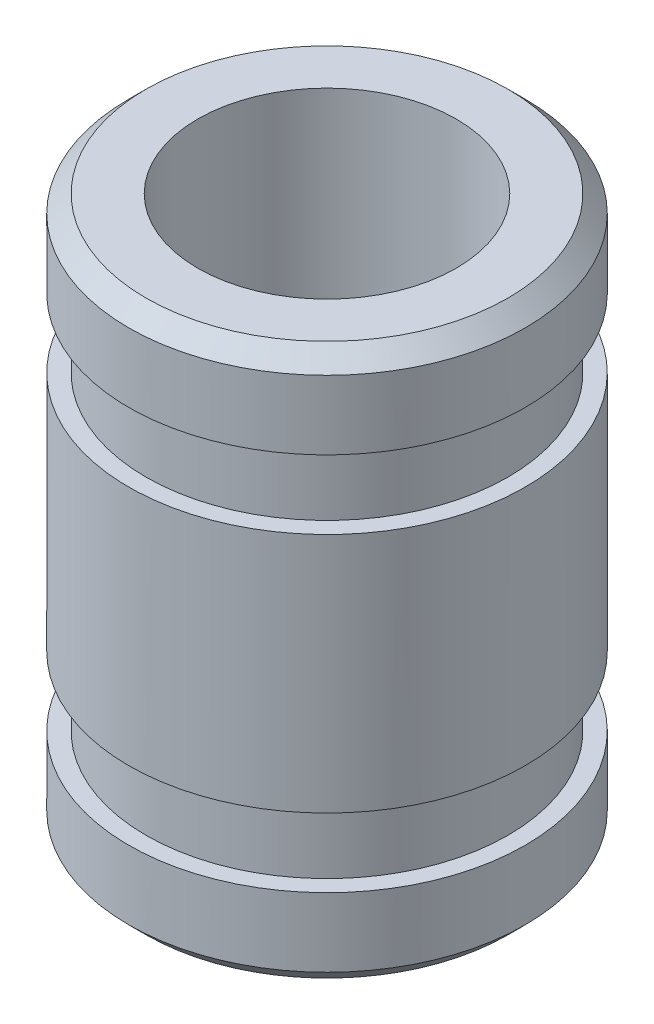
from build123d import *

# Parameters (mm, degrees)
SKETCH1_R           = 11.5
BOSS_EXTRUDE1_DEPTH = 32
SKETCH2_R           = 7.5
CUT_EXTRUDE1_DEPTH  = 32
SKETCH3_W           = 1
SKETCH3_H           = 4
SKETCH5_W           = 1
SKETCH5_H           = 4
CHAMFER2_SIZE       = 1


with BuildPart() as part:
    # Sketch1 → Boss-Extrude1 (new body)
    with BuildSketch(Plane(origin=(0, 0, 0), x_dir=(1, 0, 0), z_dir=(0, 1, 0))):
        with Locations(Location((0, 0, 0), (0, 0, 270))):
            Circle(SKETCH1_R)
    extrude(amount=BOSS_EXTRUDE1_DEPTH)

    # Sketch2 → Cut-Extrude1 (cut)
    with BuildSketch(Plane(origin=(0, 32, 0), x_dir=(1, 0, 0), z_dir=(0, 1, 0))):
        with Locations(Location((0, 0, 0), (0, 0, 270))):
            Circle(SKETCH2_R)
    extrude(amount=-CUT_EXTRUDE1_DEPTH, mode=Mode.SUBTRACT)

    # Cut-Sweep1: sweep along a path in Sketch4
    with BuildLine(Plane(origin=(0, 7, 0), x_dir=(-1, 0, 0), z_dir=(0, -1, 0))) as cut_sweep1_path:
        CenterArc((0, 0), 11, 0, 360)
    # Sketch3 → Cut-Sweep1 (sweep, cut)
    with BuildSketch(Plane.XY):
        with Locations((11, 7)):
            Rectangle(SKETCH3_W, SKETCH3_H)
    sweep(path=cut_sweep1_path.line, mode=Mode.SUBTRACT)

    # Cut-Sweep2: sweep along a path in Sketch6
    with BuildLine(Plane(origin=(0, 25, 0), x_dir=(1, 0, 0), z_dir=(0, 1, 0))) as cut_sweep2_path:
        CenterArc((0, 0), 11, 0, 360)
    # Sketch5 → Cut-Sweep2 (sweep, cut)
    with BuildSketch(Plane(origin=(0, 0, 0), x_dir=(0, 0, -1), z_dir=(1, 0, 0))):
        with Locations((11, 25)):
            Rectangle(SKETCH5_W, SKETCH5_H)
    sweep(path=cut_sweep2_path.line, mode=Mode.SUBTRACT)

    # Chamfer2
    chamfer2_edges = [part.edges().sort_by_distance(p)[0] for p in [
        (0, 0, -11.5),
        (0, 32, -11.5),
    ]]
    chamfer(chamfer2_edges, length=CHAMFER2_SIZE)


solid = part.part
